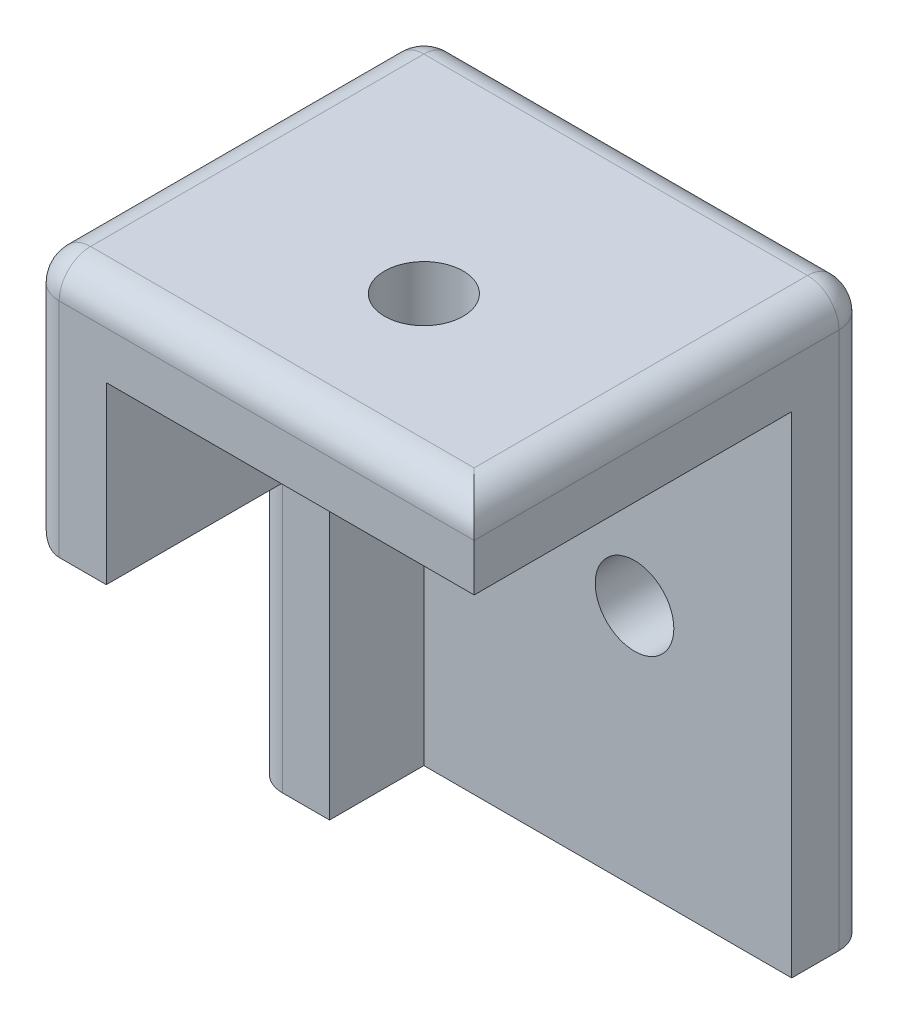
from build123d import *

# Parameters (mm, degrees)
ESQUISSE1_W        = 23.4
ESQUISSE1_H        = 31.2
ESQUISSE1_R        = 2.5
BOSS_EXTRU_1_DEPTH = 5
ESQUISSE3_W        = 23.4
ESQUISSE3_H        = 25.2
ESQUISSE3_R        = 2.5
BOSS_EXTRU_3_DEPTH = 5
BOSS_EXTRU_2_DEPTH = 5
CONG_1_R           = 2


with BuildPart() as part:
    # Esquisse1 → Boss.-Extru.1 (new body)
    with BuildSketch(Plane.XY):
        with Locations((27.545883061, -84.168430722)):
            Rectangle(ESQUISSE1_W, ESQUISSE1_H)
        with Locations((29.245883061, -84.268430722)):
            Circle(ESQUISSE1_R, mode=Mode.SUBTRACT)
    extrude(amount=BOSS_EXTRU_1_DEPTH)

    # Esquisse3 → Boss.-Extru.3 (add)
    with BuildSketch(Plane(origin=(0, -68.568430722, 0), x_dir=(1, 0, 0), z_dir=(0, 1, 0))):
        with Locations((27.545883061, -12.6)):
            Rectangle(ESQUISSE3_W, ESQUISSE3_H)
        with Locations(Location((26.045883061, -15.2, 0), (0, 0, 270))):
            Circle(ESQUISSE3_R, mode=Mode.SUBTRACT)
    extrude(amount=BOSS_EXTRU_3_DEPTH)

    # Esquisse2 → Boss.-Extru.2 (add)
    with BuildSketch(Plane(origin=(15.845883061, 0, 12.450490199), x_dir=(0, 0, -1), z_dir=(1, 0, 0))):
        Polygon((12.450490199, -99.768430722), (12.450490199, -63.568430722), (-12.749509801, -63.568430722), (-12.749509801, -79.702669736), (1.450490199, -79.702669736), (1.450490199, -99.768430722), align=None)
    extrude(amount=-BOSS_EXTRU_2_DEPTH)

    # Congé1
    cong_1_edges = [part.edges().sort_by_distance(p)[0] for p in [
        (25.045883061, -63.568430722, 25.2),
        (39.245883061, -63.568430722, 12.6),
        (25.045883061, -63.568430722, 0),
        (10.845883061, -89.735550229, 11),
        (10.845883061, -79.702669736, 18.1),
        (10.845883061, -71.635550229, 25.2),
        (10.845883061, -63.568430722, 12.6),
        (10.845883061, -81.668430722, 0),
        (39.245883061, -81.668430722, 0),
    ]]
    fillet(cong_1_edges, radius=CONG_1_R)


solid = part.part
